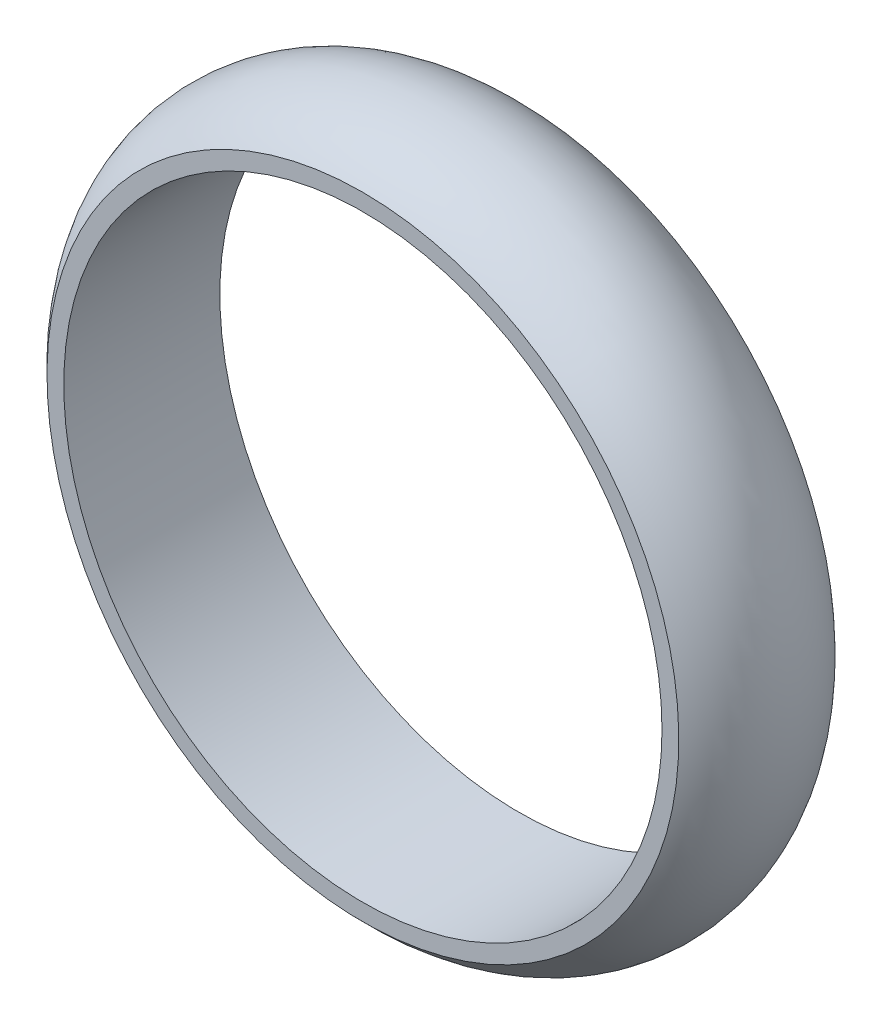
from build123d import *

# Parameters (mm, degrees)
SKETCH_1_R      = 67.5
SKETCH_1_R_2    = 57.5
EXTRUDE_1_DEPTH = 30


with BuildPart() as part:
    # 草图1 → 凸台-拉伸1 (new body)
    with BuildSketch(Plane.XY):
        Circle(SKETCH_1_R)
        Circle(SKETCH_1_R_2, mode=Mode.SUBTRACT)
    extrude(amount=EXTRUDE_1_DEPTH)

    # 草图3 → 切除-旋转1 (revolve, cut)
    with BuildSketch(Plane(origin=(0, 0, 0), x_dir=(0, 0, -1), z_dir=(1, 0, 0))):
        with BuildLine():
            Line((-30, 67.5), (-30, 60.728756555))
            ThreePointArc((-30, 60.728756555), (-23.228756555, 65.728756555), (-15, 67.5))
            Line((-15, 67.5), (-30, 67.5))
        make_face()
        with BuildLine():
            Line((0, 67.5), (-15, 67.5))
            ThreePointArc((-15, 67.5), (-6.771243445, 65.728756555), (0, 60.728756555))
            Line((0, 60.728756555), (0, 67.5))
        make_face()
    revolve(axis=Axis((0, 0, 0), (0, 0, 1)), mode=Mode.SUBTRACT)


solid = part.part
